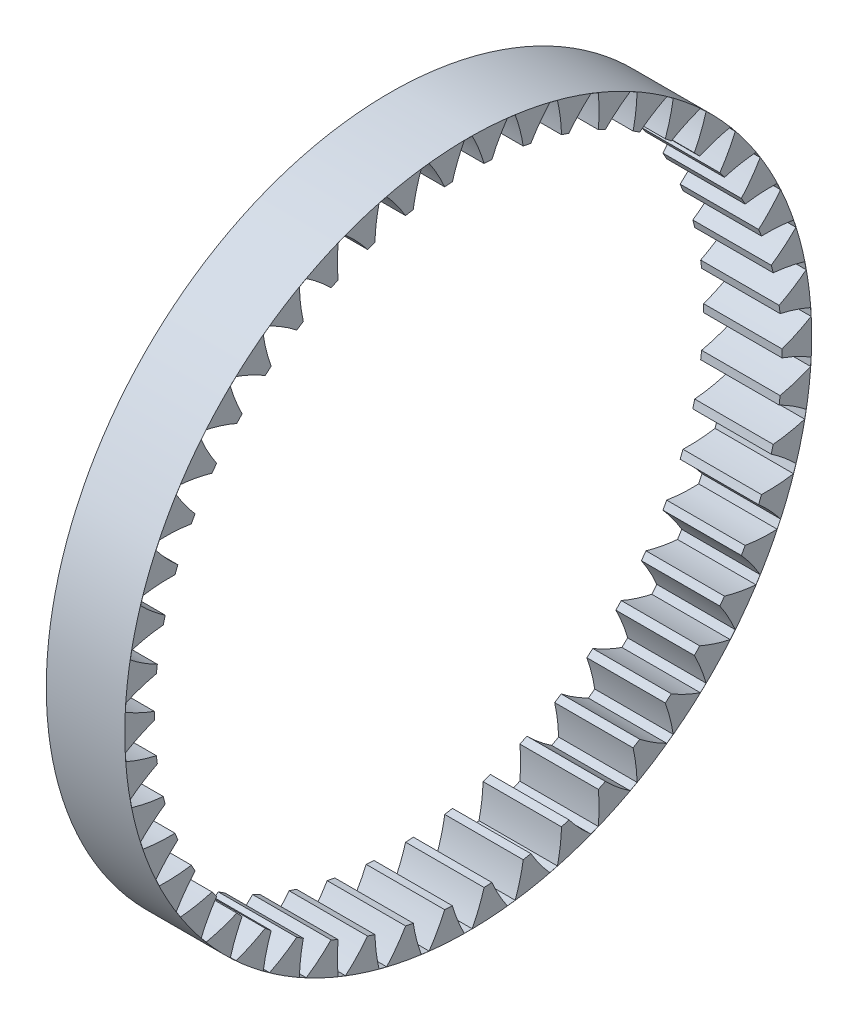
from build123d import *

# Parameters (mm, degrees)
BASPROSKE_W     = 12
BASPROSKE_H     = 4.5264
TOOTHCUT_DEPTH  = 76.246564001
TEETHCUTS_COUNT = 50
TEETHCUTS_ANGLE = 352.8


with BuildPart() as part:
    # BasProSke → Base-Revolve (revolve)
    with BuildSketch(Plane(origin=(0, 0, 0), x_dir=(1, 0, 0), z_dir=(0, 1, 0)), mode=Mode.PRIVATE) as base_revolve_sk:
        with Locations((6, 50.2632)):
            Rectangle(BASPROSKE_W, BASPROSKE_H)
    revolve(base_revolve_sk.sketch.rotate(Axis((-10, 0, 0), (1, 0, 0)), 180), axis=Axis((-10, 0, 0), (1, 0, 0)))

    # TooCutSke → ToothCut (cut, through all)
    with BuildSketch(Plane(origin=(0, 0, 0), x_dir=(0, 0, -1), z_dir=(1, 0, 0))):
        with BuildLine():
            ThreePointArc((2.426707814, 47.913185391), (1.628356337, 50.250450788), (0.603274723, 52.497533853))
            ThreePointArc((0.603274723, 52.497533853), (0, 52.501), (-0.603274723, 52.497533853))
            ThreePointArc((-0.603274723, 52.497533853), (-1.628356337, 50.250450788), (-2.426707814, 47.913185391))
            ThreePointArc((-2.426707814, 47.913185391), (0, 47.9746), (2.426707814, 47.913185391))
        make_face()
    toothcut = extrude(amount=TOOTHCUT_DEPTH, mode=Mode.SUBTRACT)

    # TeethCuts: ToothCut ×50 about axis
    teethcuts_axis = Axis((-10, 0, 0), (1, 0, 0))
    for i in range(1, TEETHCUTS_COUNT):
        add(toothcut.rotate(teethcuts_axis, i * TEETHCUTS_ANGLE / (TEETHCUTS_COUNT - 1)), mode=Mode.SUBTRACT)


solid = part.part
